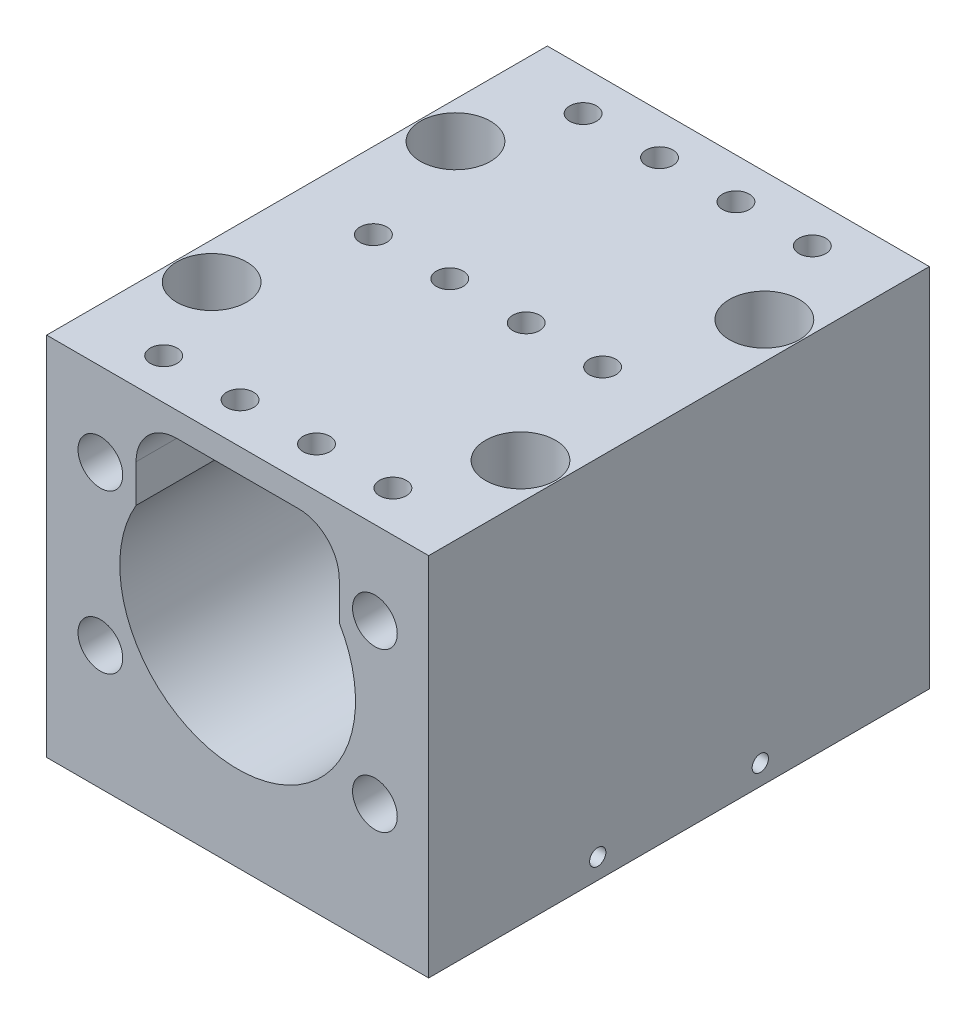
from build123d import *

# Parameters (mm, degrees)
SKETCH_1_W                       = 47
SKETCH_1_H                       = 45
EXTRUDE_1_DEPTH                  = 61.6
SKETCH_2_R                       = 14.5
CUT_EXTRUDE_1_DEPTH              = 100
SKETCH_6_R                       = 2.75
CUT_EXTRUDE_5_DEPTH              = 100
SKETCH_7_W                       = 25
SKETCH_7_H                       = 9.651530772
CUT_EXTRUDE_6_DEPTH              = 100
FILLET_1_R                       = 5
SKETCH_10_R                      = 2.75
CUT_EXTRUDE_8_DEPTH              = 100
PATTERN_LINEAR_2_COUNT           = 2
PATTERN_LINEAR_2_PITCH           = 38
PATTERN_LINEAR_2_COUNT_DIR2      = 2
PATTERN_LINEAR_2_PITCH_DIR2      = 30
SKETCH_11_R                      = 4.3
CUT_EXTRUDE_9_DEPTH              = 40
PATTERN_LINEAR_3_COUNT           = 2
PATTERN_LINEAR_3_PITCH           = 38
PATTERN_LINEAR_3_COUNT_DIR2      = 2
PATTERN_LINEAR_3_PITCH_DIR2      = 30
SKETCH_12_R                      = 1.65
CUT_EXTRUDE_10_DEPTH             = 5
PATTERN_LINEAR_4_COUNT           = 4
PATTERN_LINEAR_4_PITCH           = 9.4
PATTERN_LINEAR_5_COPY_1_SKETCH_R = 1.65
PATTERN_LINEAR_5_COPY_1_DEPTH    = 5
PATTERN_LINEAR_5_COPY_2_SKETCH_R = 1.65
PATTERN_LINEAR_5_COPY_2_DEPTH    = 5
PATTERN_LINEAR_5_COPY_3_SKETCH_R = 1.65
PATTERN_LINEAR_5_COPY_3_DEPTH    = 5
PATTERN_LINEAR_5_COPY_4_SKETCH_R = 1.65
PATTERN_LINEAR_5_COPY_4_DEPTH    = 5
PATTERN_LINEAR_6_COPY_1_SKETCH_R = 1.65
PATTERN_LINEAR_6_COPY_1_DEPTH    = 5
PATTERN_LINEAR_6_COPY_2_SKETCH_R = 1.65
PATTERN_LINEAR_6_COPY_2_DEPTH    = 5
PATTERN_LINEAR_6_COPY_3_SKETCH_R = 1.65
PATTERN_LINEAR_6_COPY_3_DEPTH    = 5
PATTERN_LINEAR_6_COPY_4_SKETCH_R = 1.65
PATTERN_LINEAR_6_COPY_4_DEPTH    = 5
SKETCH_13_R                      = 1
CUT_EXTRUDE_11_DEPTH             = 100


with BuildPart() as part:
    # Эскиз1 → Бобышка-Вытянуть1 (new body)
    with BuildSketch(Plane.XY):
        Rectangle(SKETCH_1_W, SKETCH_1_H)
    extrude(amount=EXTRUDE_1_DEPTH)

    # Эскиз2 → Вырез-Вытянуть1 (cut)
    with BuildSketch(Plane.XY.offset(61.6)):
        with Locations((0, 2.5)):
            Circle(SKETCH_2_R)
    extrude(amount=-CUT_EXTRUDE_1_DEPTH, mode=Mode.SUBTRACT)

    # Эскиз6 → Вырез-Вытянуть5 (cut)
    with BuildSketch(Plane(origin=(0, 0, 0), x_dir=(-1, 0, 0), z_dir=(0, 0, -1))):
        with Locations((-16.887495374, 12.25)):
            Circle(SKETCH_6_R)
        with Locations((-16.887495374, -7.25)):
            Circle(SKETCH_6_R)
        with Locations((16.887495374, 12.25)):
            Circle(SKETCH_6_R)
        with Locations((16.887495374, -7.25)):
            Circle(SKETCH_6_R)
    extrude(amount=-CUT_EXTRUDE_5_DEPTH, mode=Mode.SUBTRACT)

    # Эскиз7 → Вырез-Вытянуть6 (cut)
    with BuildSketch(Plane(origin=(0, 0, 0), x_dir=(-1, 0, 0), z_dir=(0, 0, -1))):
        with Locations((0, 14.674234614)):
            Rectangle(SKETCH_7_W, SKETCH_7_H)
    extrude(amount=-CUT_EXTRUDE_6_DEPTH, mode=Mode.SUBTRACT)

    # Скругление1
    fillet_1_edges = [part.edges().sort_by_distance(p)[0] for p in [
        (12.5, 19.5, 30.8),
        (-12.5, 19.5, 30.8),
    ]]
    fillet(fillet_1_edges, radius=FILLET_1_R)

    # Эскиз10 → Вырез-Вытянуть8 (cut)
    with BuildSketch(Plane(origin=(0, 22.5, 0), x_dir=(1, 0, 0), z_dir=(0, 1, 0))):
        with Locations((-19, -15.8)):
            Circle(SKETCH_10_R)
    cut_extrude_8 = extrude(amount=-CUT_EXTRUDE_8_DEPTH, mode=Mode.SUBTRACT)

    # Линейный массив2: Cut-Extrude 8 2 × 2
    with Locations(*[(i * PATTERN_LINEAR_2_PITCH, 0, j * PATTERN_LINEAR_2_PITCH_DIR2) for i in range(PATTERN_LINEAR_2_COUNT) for j in range(PATTERN_LINEAR_2_COUNT_DIR2) if (i, j) != (0, 0)]):
        add(cut_extrude_8, mode=Mode.SUBTRACT)

    # Эскиз11 → Вырез-Вытянуть9 (cut)
    with BuildSketch(Plane(origin=(0, 22.5, 0), x_dir=(1, 0, 0), z_dir=(0, 1, 0))):
        with Locations((-19, -15.8)):
            Circle(SKETCH_11_R)
    cut_extrude_9 = extrude(amount=-CUT_EXTRUDE_9_DEPTH, mode=Mode.SUBTRACT)

    # Линейный массив3: Cut-Extrude 9 2 × 2
    with Locations(*[(i * PATTERN_LINEAR_3_PITCH, 0, j * PATTERN_LINEAR_3_PITCH_DIR2) for i in range(PATTERN_LINEAR_3_COUNT) for j in range(PATTERN_LINEAR_3_COUNT_DIR2) if (i, j) != (0, 0)]):
        add(cut_extrude_9, mode=Mode.SUBTRACT)

    # Эскиз12 → Вырез-Вытянуть10 (cut)
    with BuildSketch(Plane(origin=(0, 22.5, 0), x_dir=(1, 0, 0), z_dir=(0, 1, 0))):
        with Locations((-14.1, -5)):
            Circle(SKETCH_12_R)
    cut_extrude_10 = extrude(amount=-CUT_EXTRUDE_10_DEPTH, mode=Mode.SUBTRACT)

    # Линейный массив4: Вырез-Вытянуть10 ×4
    with Locations(*[(i * PATTERN_LINEAR_4_PITCH, 0, 0) for i in range(1, PATTERN_LINEAR_4_COUNT)]):
        add(cut_extrude_10, mode=Mode.SUBTRACT)

    # Линейный массив5 copy 1 sketch → Линейный массив5 copy 1 (cut)
    with BuildSketch(Plane(origin=(9.4, 22.5, 25.8), x_dir=(1, 0, 0), z_dir=(0, 1, 0))):
        with Locations((-14.1, -5)):
            Circle(PATTERN_LINEAR_5_COPY_1_SKETCH_R)
    extrude(amount=-PATTERN_LINEAR_5_COPY_1_DEPTH, mode=Mode.SUBTRACT)

    # Линейный массив5 copy 2 sketch → Линейный массив5 copy 2 (cut)
    with BuildSketch(Plane(origin=(18.8, 22.5, 25.8), x_dir=(1, 0, 0), z_dir=(0, 1, 0))):
        with Locations((-14.1, -5)):
            Circle(PATTERN_LINEAR_5_COPY_2_SKETCH_R)
    extrude(amount=-PATTERN_LINEAR_5_COPY_2_DEPTH, mode=Mode.SUBTRACT)

    # Линейный массив5 copy 3 sketch → Линейный массив5 copy 3 (cut)
    with BuildSketch(Plane(origin=(28.2, 22.5, 25.8), x_dir=(1, 0, 0), z_dir=(0, 1, 0))):
        with Locations((-14.1, -5)):
            Circle(PATTERN_LINEAR_5_COPY_3_SKETCH_R)
    extrude(amount=-PATTERN_LINEAR_5_COPY_3_DEPTH, mode=Mode.SUBTRACT)

    # Линейный массив5 copy 4 sketch → Линейный массив5 copy 4 (cut)
    with BuildSketch(Plane(origin=(0, 22.5, 25.8), x_dir=(1, 0, 0), z_dir=(0, 1, 0))):
        with Locations((-14.1, -5)):
            Circle(PATTERN_LINEAR_5_COPY_4_SKETCH_R)
    extrude(amount=-PATTERN_LINEAR_5_COPY_4_DEPTH, mode=Mode.SUBTRACT)

    # Линейный массив6 copy 1 sketch → Линейный массив6 copy 1 (cut)
    with BuildSketch(Plane(origin=(9.4, 22.5, 51.6), x_dir=(1, 0, 0), z_dir=(0, 1, 0))):
        with Locations((-14.1, -5)):
            Circle(PATTERN_LINEAR_6_COPY_1_SKETCH_R)
    extrude(amount=-PATTERN_LINEAR_6_COPY_1_DEPTH, mode=Mode.SUBTRACT)

    # Линейный массив6 copy 2 sketch → Линейный массив6 copy 2 (cut)
    with BuildSketch(Plane(origin=(18.8, 22.5, 51.6), x_dir=(1, 0, 0), z_dir=(0, 1, 0))):
        with Locations((-14.1, -5)):
            Circle(PATTERN_LINEAR_6_COPY_2_SKETCH_R)
    extrude(amount=-PATTERN_LINEAR_6_COPY_2_DEPTH, mode=Mode.SUBTRACT)

    # Линейный массив6 copy 3 sketch → Линейный массив6 copy 3 (cut)
    with BuildSketch(Plane(origin=(28.2, 22.5, 51.6), x_dir=(1, 0, 0), z_dir=(0, 1, 0))):
        with Locations((-14.1, -5)):
            Circle(PATTERN_LINEAR_6_COPY_3_SKETCH_R)
    extrude(amount=-PATTERN_LINEAR_6_COPY_3_DEPTH, mode=Mode.SUBTRACT)

    # Линейный массив6 copy 4 sketch → Линейный массив6 copy 4 (cut)
    with BuildSketch(Plane(origin=(0, 22.5, 51.6), x_dir=(1, 0, 0), z_dir=(0, 1, 0))):
        with Locations((-14.1, -5)):
            Circle(PATTERN_LINEAR_6_COPY_4_SKETCH_R)
    extrude(amount=-PATTERN_LINEAR_6_COPY_4_DEPTH, mode=Mode.SUBTRACT)

    # Эскиз13 → Вырез-Вытянуть11 (cut)
    with BuildSketch(Plane(origin=(23.5, 0, 0), x_dir=(0, 0, -1), z_dir=(1, 0, 0))):
        with Locations((-40.8, -20)):
            Circle(SKETCH_13_R)
        with Locations((-20.8, -20)):
            Circle(SKETCH_13_R)
    extrude(amount=-CUT_EXTRUDE_11_DEPTH, mode=Mode.SUBTRACT)


solid = part.part
